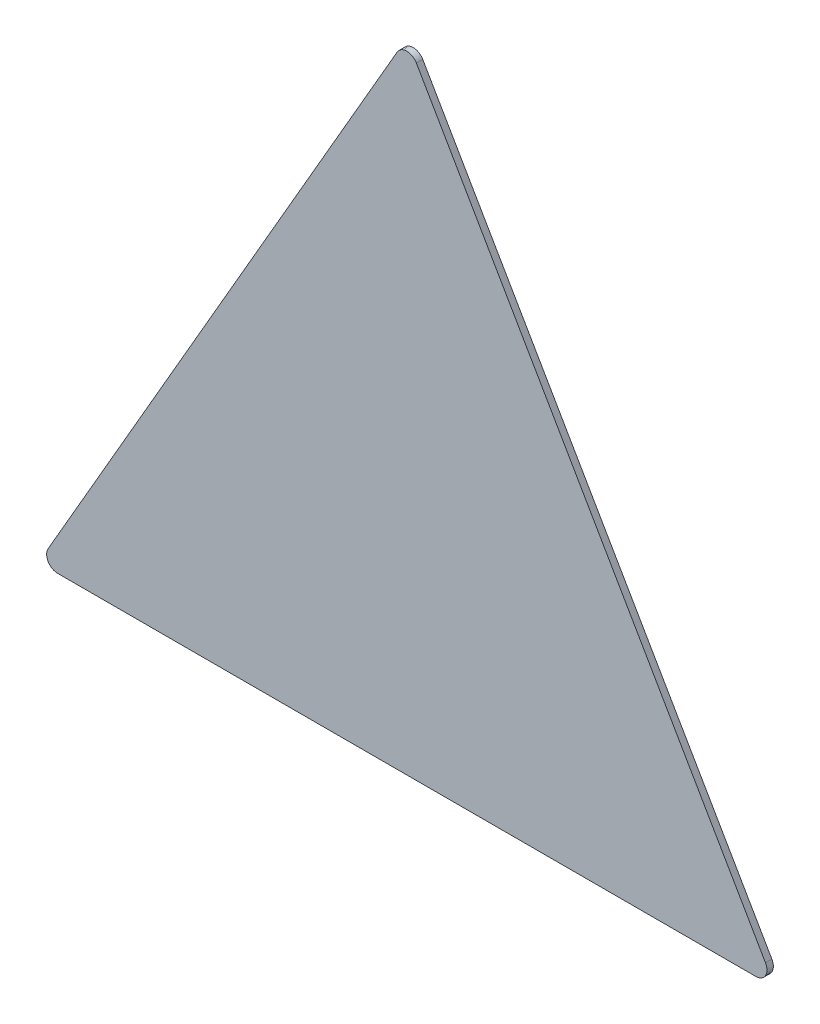
from build123d import *

# Parameters (mm, degrees)
BOSS_EXTRU_1_DEPTH = 1.9


with BuildPart() as part:
    # Esquisse1 → Boss.-Extru.1 (new body)
    with BuildSketch(Plane.XY):
        with BuildLine():
            Line((103.141629659, -93.104422445), (-104.537862265, -93.104422445))
            add(Edge.make_bspline(
                [(-104.537862265, -93.104422445), (-104.576313156, -93.104422445), (-104.614764048, -93.104422445), (-104.653209533, -93.104125461), (-104.768513557, -93.101452602), (-104.883671631, -93.090761166), (-104.960260867, -93.08067219), (-105.150982063, -93.049552521), (-105.339086356, -93.007455152), (-105.450747192, -92.977883193), (-105.671146078, -92.909389067), (-105.884660771, -92.820748262), (-105.989422935, -92.771633631), (-106.194408631, -92.664300797), (-106.389220526, -92.539730583), (-106.48384332, -92.473274378), (-106.667043194, -92.332296267), (-106.837192824, -92.17573974), (-106.91879647, -92.093784348), (-107.074644208, -91.922954256), (-107.214938405, -91.739155447), (-107.281028071, -91.644254137), (-107.404754439, -91.448928258), (-107.51089869, -91.243516958), (-107.55945325, -91.138557181), (-107.64728317, -90.924663828), (-107.716066547, -90.703891793), (-107.745614057, -90.592075935), (-107.794855636, -90.366164197), (-107.824060167, -90.136851737), (-107.833655342, -90.021622167), (-107.842835855, -89.790570025), (-107.832005382, -89.559439241), (-107.821514669, -89.444212724), (-107.790403383, -89.216374252), (-107.738630165, -88.992714706), (-107.708207682, -88.882559264), (-107.650563592, -88.701220982), (-107.582401802, -88.523090493), (-107.553106564, -88.452964824), (-107.50557398, -88.350258026), (-107.451336724, -88.251263547), (-107.432968479, -88.218893501), (-107.414357288, -88.186657973), (-107.395746098, -88.154422445)],
                knots=[0, 0, 0, 0, 0, 0, 0.027851934, 0.027851934, 0.027851934, 0.083555801, 0.083555801, 0.083555801, 0.167111603, 0.167111603, 0.167111603, 0.250667404, 0.250667404, 0.250667404, 0.334223205, 0.334223205, 0.334223205, 0.417779006, 0.417779006, 0.417779006, 0.501334808, 0.501334808, 0.501334808, 0.584890609, 0.584890609, 0.584890609, 0.66844641, 0.66844641, 0.66844641, 0.752002212, 0.752002212, 0.752002212, 0.835558013, 0.835558013, 0.835558013, 0.918223942, 0.918223942, 0.918223942, 0.973037938, 0.973037938, 0.973037938, 1, 1, 1, 1, 1, 1], degree=5))
            Line((-107.395746098, -88.154422445), (-3.556000135, 91.701293407))
            add(Edge.make_bspline(
                [(-3.556000135, 91.701293407), (-3.53677469, 91.734592855), (-3.517549244, 91.767892304), (-3.498069305, 91.801038579), (-3.43810253, 91.899558363), (-3.371264438, 91.993942462), (-3.324232511, 92.055226199), (-3.201921489, 92.204835765), (-3.071411952, 92.346690177), (-2.989971465, 92.428605318), (-2.820454369, 92.585229289), (-2.636931834, 92.725818035), (-2.542016234, 92.791987415), (-2.346570425, 92.915843818), (-2.141283507, 93.022270761), (-2.036419348, 93.070988402), (-1.822728786, 93.159155091), (-1.602072042, 93.22823073), (-1.490294768, 93.257923864), (-1.264427699, 93.307476918), (-1.035106162, 93.337075852), (-0.919874384, 93.346860527), (-0.688854027, 93.356347766), (-0.457890497, 93.345565733), (-0.342715384, 93.335135327), (-0.113563347, 93.304251593), (0.112022532, 93.253433727), (0.223631661, 93.223114692), (0.443897755, 93.152803282), (0.657090436, 93.063438917), (0.761679759, 93.014133797), (0.96636704, 92.906558284), (1.161116934, 92.781613428), (1.255660668, 92.714914945), (1.437418929, 92.574052545), (1.605227169, 92.41738585), (1.685413339, 92.335961486), (1.813634853, 92.195371099), (1.933819487, 92.047276013), (1.979902479, 91.986842758), (2.045082883, 91.894324933), (2.103695988, 91.797856852), (2.122545148, 91.765764463), (2.141156339, 91.733528935), (2.159767529, 91.701293407)],
                knots=[0, 0, 0, 0, 0, 0, 0.027851934, 0.027851934, 0.027851934, 0.083555801, 0.083555801, 0.083555801, 0.167111603, 0.167111603, 0.167111603, 0.250667404, 0.250667404, 0.250667404, 0.334223205, 0.334223205, 0.334223205, 0.417779006, 0.417779006, 0.417779006, 0.501334808, 0.501334808, 0.501334808, 0.584890609, 0.584890609, 0.584890609, 0.66844641, 0.66844641, 0.66844641, 0.752002212, 0.752002212, 0.752002212, 0.835558013, 0.835558013, 0.835558013, 0.918223942, 0.918223942, 0.918223942, 0.973037938, 0.973037938, 0.973037938, 1, 1, 1, 1, 1, 1], degree=5))
            Line((2.159767529, 91.701293407), (105.997013492, -88.150092318))
            add(Edge.make_bspline(
                [(105.997013492, -88.150092318), (105.997513492, -88.150958343), (105.998013492, -88.151824369), (105.998513492, -88.152690394), (105.999013492, -88.15355642), (106.018738937, -88.187721894), (106.037964383, -88.221021342), (106.05692993, -88.254464601), (106.112267178, -88.355657245), (106.16058716, -88.46073278), (106.190144469, -88.532105492), (106.258554643, -88.712834727), (106.316149398, -88.896786508), (106.346369749, -89.008273609), (106.397251538, -89.233391706), (106.427243696, -89.462621256), (106.43709026, -89.577905267), (106.446630147, -89.809094504), (106.436155125, -90.040091661), (106.42591376, -90.155265507), (106.395423071, -90.384410308), (106.344915957, -90.610042473), (106.314742328, -90.721690999), (106.244722998, -90.942074145), (106.155695658, -91.155471889), (106.106553546, -91.260157873), (105.999259557, -91.464970991), (105.874440278, -91.659600259), (105.807819725, -91.75412963), (105.666497608, -91.937139248), (105.509695105, -92.107093417), (105.427633487, -92.188590241), (105.256608973, -92.344190568), (105.072620822, -92.484138664), (104.977626674, -92.550063114), (104.782119906, -92.673539742), (104.576539539, -92.77972567), (104.471505092, -92.828253704), (104.258635545, -92.915229776), (104.039054087, -92.982222627), (103.928445434, -93.010953705), (103.74257983, -93.0517016), (103.554233407, -93.081737003), (103.478855177, -93.091429417), (103.366142188, -93.101618391), (103.253291827, -93.104144789), (103.216074423, -93.104422445), (103.178852041, -93.104422445), (103.141629659, -93.104422445)],
                knots=[0, 0, 0, 0, 0, 0, 0.000723486, 0.000723486, 0.000723486, 0.000723486, 0.028555269, 0.028555269, 0.028555269, 0.084218835, 0.084218835, 0.084218835, 0.167714185, 0.167714185, 0.167714185, 0.251209535, 0.251209535, 0.251209535, 0.334704885, 0.334704885, 0.334704885, 0.418200235, 0.418200235, 0.418200235, 0.501695585, 0.501695585, 0.501695585, 0.585190935, 0.585190935, 0.585190935, 0.668686285, 0.668686285, 0.668686285, 0.752181634, 0.752181634, 0.752181634, 0.835676984, 0.835676984, 0.835676984, 0.918283106, 0.918283106, 0.918283106, 0.973057445, 0.973057445, 0.973057445, 1, 1, 1, 1, 1, 1], degree=5))
        make_face()
    extrude(amount=BOSS_EXTRU_1_DEPTH)


solid = part.part
